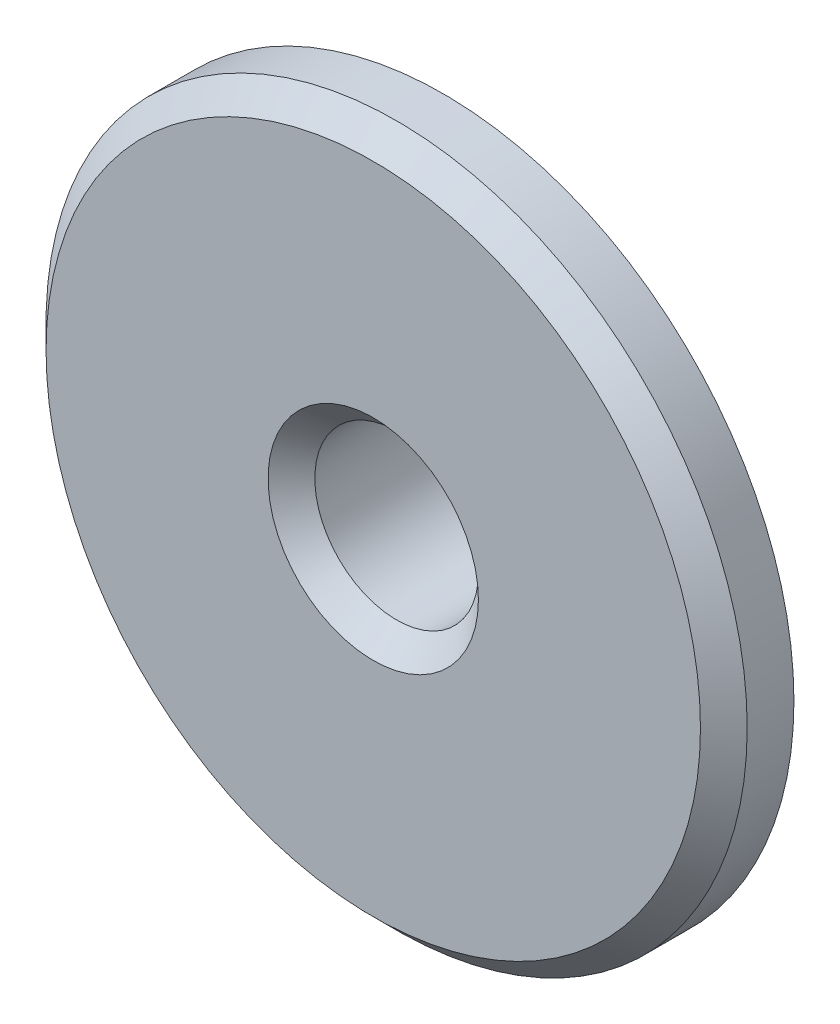
from build123d import *

# Parameters (mm, degrees)
CHAMFER1_SIZE = 1
CHAMFER2_SIZE = 1


with BuildPart() as part:
    # Sketch1 → Revolve1 (revolve)
    with BuildSketch(Plane.ZY, mode=Mode.PRIVATE) as revolve1_sk:
        Polygon((-8, 3.5), (0, 3.5), (0, 15), (-3, 15), (-3, 5), (-8, 5), align=None)
    revolve(revolve1_sk.sketch.rotate(Axis((0, 0, 0), (0, 0, -1)), 90), axis=Axis((0, 0, 0), (0, 0, -1)))

    # Chamfer1
    chamfer1_edges = [part.edges().sort_by_distance(p)[0] for p in [
        (-5, 0, -8),
    ]]
    chamfer(chamfer1_edges, length=CHAMFER1_SIZE)

    # Chamfer2
    chamfer2_edges = [part.edges().sort_by_distance(p)[0] for p in [
        (-15, 0, 0),
        (-3.5, 0, 0),
    ]]
    chamfer(chamfer2_edges, length=CHAMFER2_SIZE)


solid = part.part
